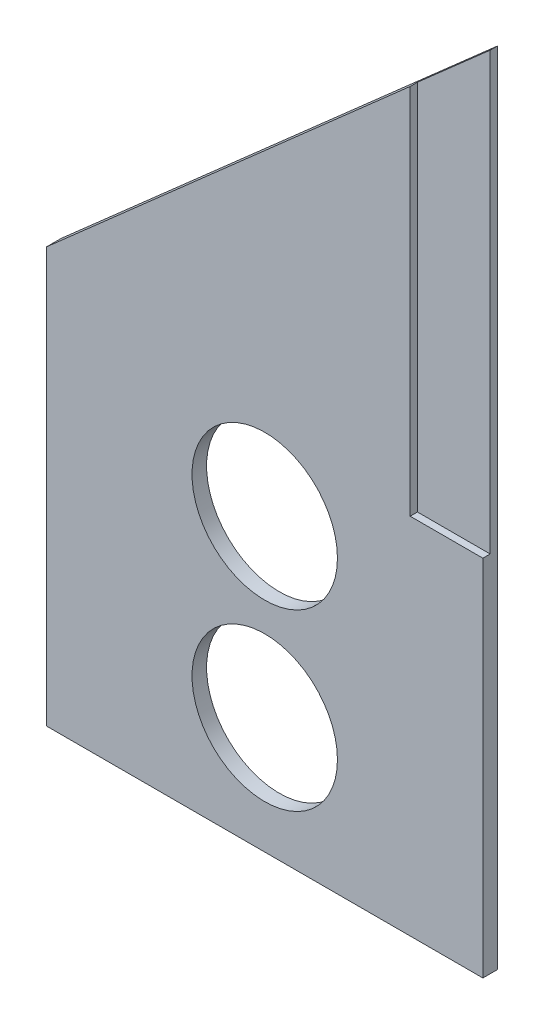
from build123d import *

# Parameters (mm, degrees)
BOSS_EXTRUDE3_DEPTH = 1
SKETCH2_W           = 5
SKETCH2_H           = 30
CUT_EXTRUDE6_DEPTH  = 0.5
SKETCH3_R           = 5
CUT_EXTRUDE7_DEPTH  = 9


with BuildPart() as part:
    # Sketch1 → Boss-Extrude3 (new body)
    with BuildSketch(Plane.XY):
        Polygon((-24.880558789, 19.329851987), (-54.880558789, -7.127661123), (-54.880558789, -35.670148013), (-24.880558789, -35.670148013), align=None)
    extrude(amount=BOSS_EXTRUDE3_DEPTH)

    # Sketch2 → Cut-Extrude6 (cut)
    with BuildSketch(Plane.XY.offset(1)):
        with Locations((-27.380558789, 4.329851987)):
            Rectangle(SKETCH2_W, SKETCH2_H)
    extrude(amount=-CUT_EXTRUDE6_DEPTH, mode=Mode.SUBTRACT)

    # Sketch3 → Cut-Extrude7 (cut)
    with BuildSketch(Plane.XY.offset(1)):
        with Locations((-39.880558789, -27.670148013)):
            Circle(SKETCH3_R)
        with Locations((-39.880558789, -15.670148013)):
            Circle(SKETCH3_R)
    extrude(amount=-CUT_EXTRUDE7_DEPTH, mode=Mode.SUBTRACT)


solid = part.part
